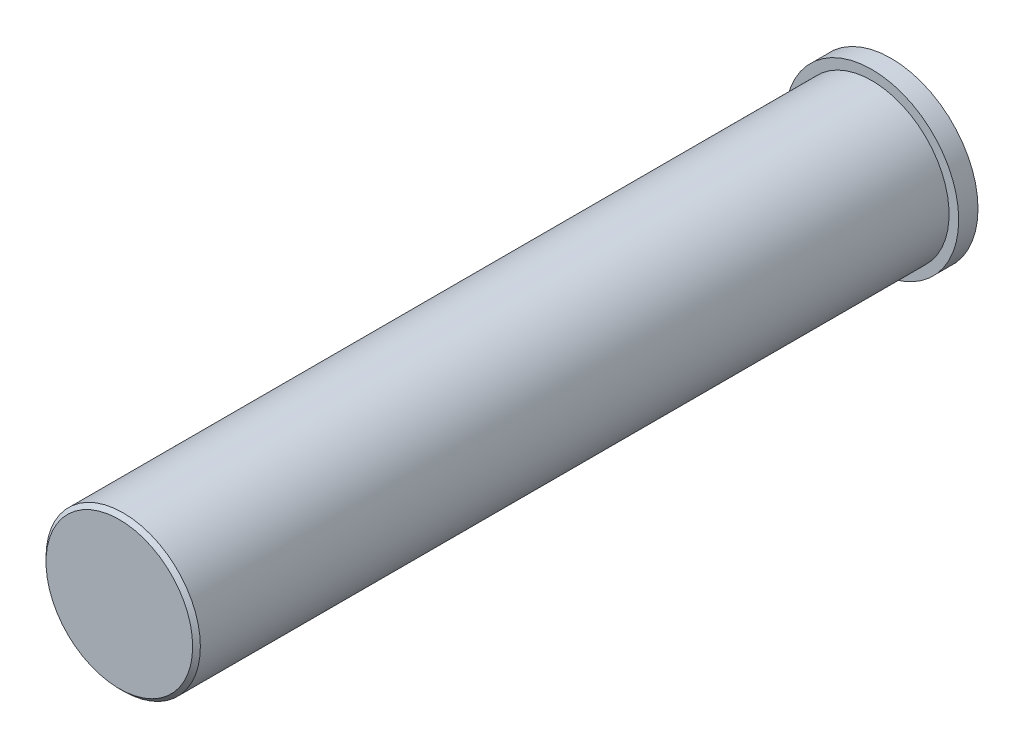
from build123d import *

# Parameters (mm, degrees)
SKETCH_1_R          = 2
EXTRUDE_1_DEPTH     = 20
SKETCH_2_R          = 2.25
EXTRUDE_2_DEPTH     = 0.5
SKETCH_3_R          = 1.5
CUT_EXTRUDE_1_DEPTH = 8
CHAMFER_1_SIZE      = 0.1


with BuildPart() as part:
    # 草图1 → 凸台-拉伸1 (new body)
    with BuildSketch(Plane.XY):
        Circle(SKETCH_1_R)
    extrude(amount=EXTRUDE_1_DEPTH)

    # 草图2 → 凸台-拉伸2 (add)
    with BuildSketch(Plane(origin=(0, 0, 0), x_dir=(-1, 0, 0), z_dir=(0, 0, -1))):
        Circle(SKETCH_2_R)
    extrude(amount=-EXTRUDE_2_DEPTH)

    # 草图3 → 切除-拉伸1 (cut)
    with BuildSketch(Plane(origin=(0, 0, 0), x_dir=(-1, 0, 0), z_dir=(0, 0, -1))):
        Circle(SKETCH_3_R)
    extrude(amount=-CUT_EXTRUDE_1_DEPTH, mode=Mode.SUBTRACT)

    # 倒角1
    chamfer_1_edges = [part.edges().sort_by_distance(p)[0] for p in [
        (-2, 0, 20),
    ]]
    chamfer(chamfer_1_edges, length=CHAMFER_1_SIZE)


solid = part.part
